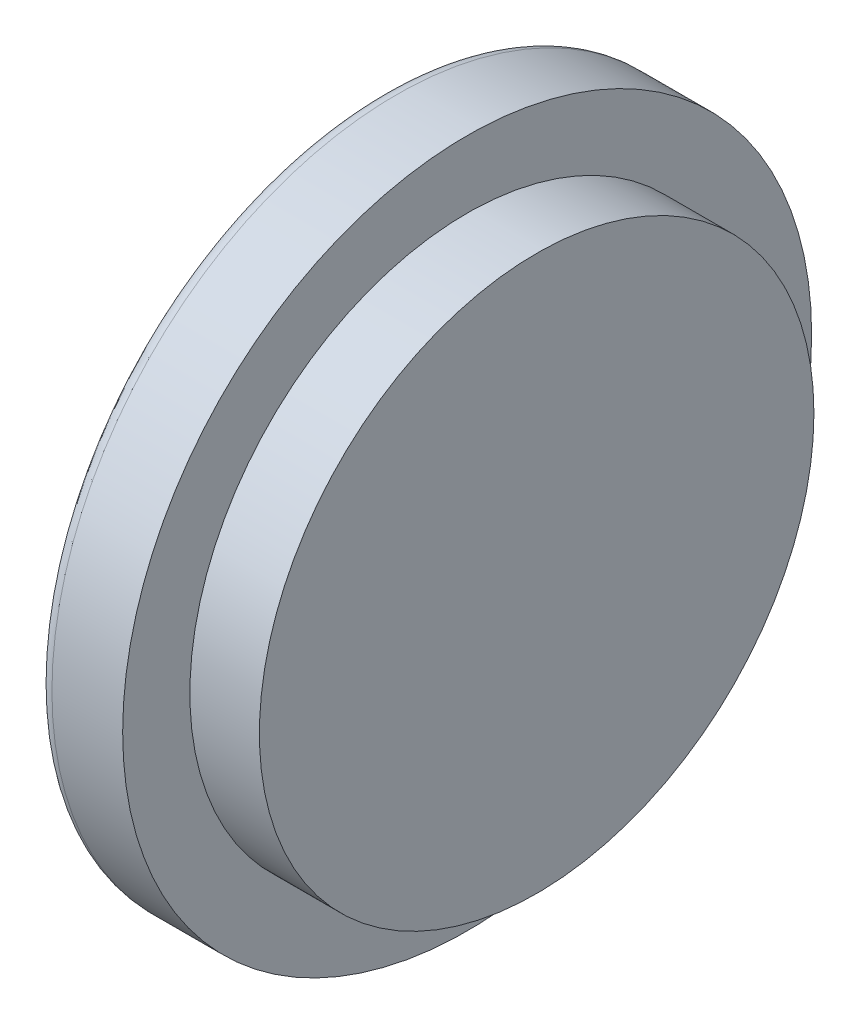
from build123d import *

# Parameters (mm, degrees)
SKETCH1_R           = 154.626985005
BOSS_EXTRUDE1_DEPTH = 38.1
BOSS_EXTRUDE2_START = -38.1
SKETCH2_R           = 124.46
BOSS_EXTRUDE2_DEPTH = 69.3
SKETCH3_R           = 139.7
CUT_EXTRUDE1_DEPTH  = 6.35
FILLET1_R           = 6.35


with BuildPart() as part:
    # Sketch1 → Boss-Extrude1 (new body)
    with BuildSketch(Plane(origin=(0, 0, 0), x_dir=(0, 0, -1), z_dir=(1, 0, 0))):
        with Locations(Location((0, 0, 0), (0, 0, 180))):
            Circle(SKETCH1_R)
    extrude(amount=BOSS_EXTRUDE1_DEPTH)

    # Sketch2 → Boss-Extrude2 (add)
    with BuildSketch(Plane(origin=(38.1, 0, 0), x_dir=(0, 0, -1), z_dir=(1, 0, 0)).offset(BOSS_EXTRUDE2_START)):
        Circle(SKETCH2_R)
    extrude(amount=BOSS_EXTRUDE2_DEPTH)

    # Sketch3 → Cut-Extrude1 (cut)
    with BuildSketch(Plane.ZY):
        Circle(SKETCH3_R)
    extrude(amount=-CUT_EXTRUDE1_DEPTH, mode=Mode.SUBTRACT)

    # Fillet1
    fillet1_edges = [part.edges().sort_by_distance(p)[0] for p in [
        (0, 0, -154.626985005),
    ]]
    fillet(fillet1_edges, radius=FILLET1_R)


solid = part.part
